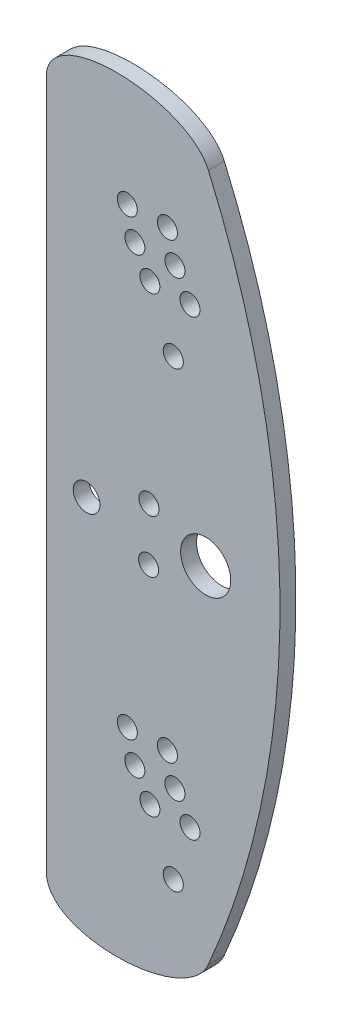
from build123d import *

# Parameters (mm, degrees)
SKETCH1_R           = 12.0000014
SKETCH1_R_2         = 29.99994
SKETCH1_R_3         = 15.99946
BOSS_EXTRUDE1_DEPTH = 19.05


with BuildPart() as part:
    # Sketch1 → Boss-Extrude1 (new body)
    with BuildSketch(Plane.XY):
        with BuildLine():
            Line((1666.449914345, 1807.663309633), (1666.449914345, 984.292129537))
            add(Edge.make_bspline(
                [(1860.24643809, 984.292129537), (1834.442562073, 925.070762843), (1666.449914345, 919.693288289), (1666.449914345, 984.292129537)],
                knots=[0, 0, 0, 0, 7.629784399, 7.629784399, 7.629784399, 7.629784399], degree=3))
            ThreePointArc((1860.24643809, 984.292129537), (1946.092561687, 1395.955210336), (1860.46260196, 1807.663309633))
            add(Edge.make_bspline(
                [(1860.46260196, 1807.663309633), (1834.661077492, 1866.964288613), (1666.449914345, 1872.334205504), (1666.449914345, 1807.663309633)],
                knots=[0, 0, 0, 0, 7.638294788, 7.638294788, 7.638294788, 7.638294788], degree=3))
        make_face()
        with Locations(Location((1811.402116463, 1181.948319082, 0), (0, 0, 180))):
            Circle(SKETCH1_R, mode=Mode.SUBTRACT)
        with Locations(Location((1820.402123863, 1146.948389082, 0), (0, 0, 180))):
            Circle(SKETCH1_R, mode=Mode.SUBTRACT)
        with Locations(Location((1838.402113263, 1115.698388082, 0), (0, 0, 180))):
            Circle(SKETCH1_R, mode=Mode.SUBTRACT)
        with Locations(Location((1772.402194463, 1146.948389082, 0), (0, 0, 180))):
            Circle(SKETCH1_R, mode=Mode.SUBTRACT)
        with Locations(Location((1790.402183863, 1115.698388082, 0), (0, 0, 180))):
            Circle(SKETCH1_R, mode=Mode.SUBTRACT)
        with Locations(Location((1763.402187063, 1181.948319082, 0), (0, 0, 180))):
            Circle(SKETCH1_R, mode=Mode.SUBTRACT)
        with Locations(Location((1818.401594463, 1051.948325082, 0), (0, 0, 180))):
            Circle(SKETCH1_R, mode=Mode.SUBTRACT)
        with Locations(Location((1811.402116463, 1723.918527241, 0), (0, 0, 180))):
            Circle(SKETCH1_R, mode=Mode.SUBTRACT)
        with Locations(Location((1820.402123863, 1688.918597241, 0), (0, 0, 180))):
            Circle(SKETCH1_R, mode=Mode.SUBTRACT)
        with Locations(Location((1838.402113263, 1657.668596241, 0), (0, 0, 180))):
            Circle(SKETCH1_R, mode=Mode.SUBTRACT)
        with Locations(Location((1772.402194463, 1688.918597241, 0), (0, 0, 180))):
            Circle(SKETCH1_R, mode=Mode.SUBTRACT)
        with Locations(Location((1790.402183863, 1657.668596241, 0), (0, 0, 180))):
            Circle(SKETCH1_R, mode=Mode.SUBTRACT)
        with Locations(Location((1763.402187063, 1723.918527241, 0), (0, 0, 180))):
            Circle(SKETCH1_R, mode=Mode.SUBTRACT)
        with Locations(Location((1818.401594463, 1593.918533241, 0), (0, 0, 180))):
            Circle(SKETCH1_R, mode=Mode.SUBTRACT)
        with Locations(Location((1788.861738175, 1363.125382024, 0), (0, 0, 180))):
            Circle(SKETCH1_R, mode=Mode.SUBTRACT)
        with Locations(Location((1789.336065957, 1426.620354396, 0), (0, 0, 180))):
            Circle(SKETCH1_R, mode=Mode.SUBTRACT)
        with Locations(Location((1857.192561687, 1395.955210336, 0), (0, 0, 180))):
            Circle(SKETCH1_R_2, mode=Mode.SUBTRACT)
        with Locations(Location((1714.690199276, 1395.955210336, 0), (0, 0, 180))):
            Circle(SKETCH1_R_3, mode=Mode.SUBTRACT)
    extrude(amount=BOSS_EXTRUDE1_DEPTH)


solid = part.part
